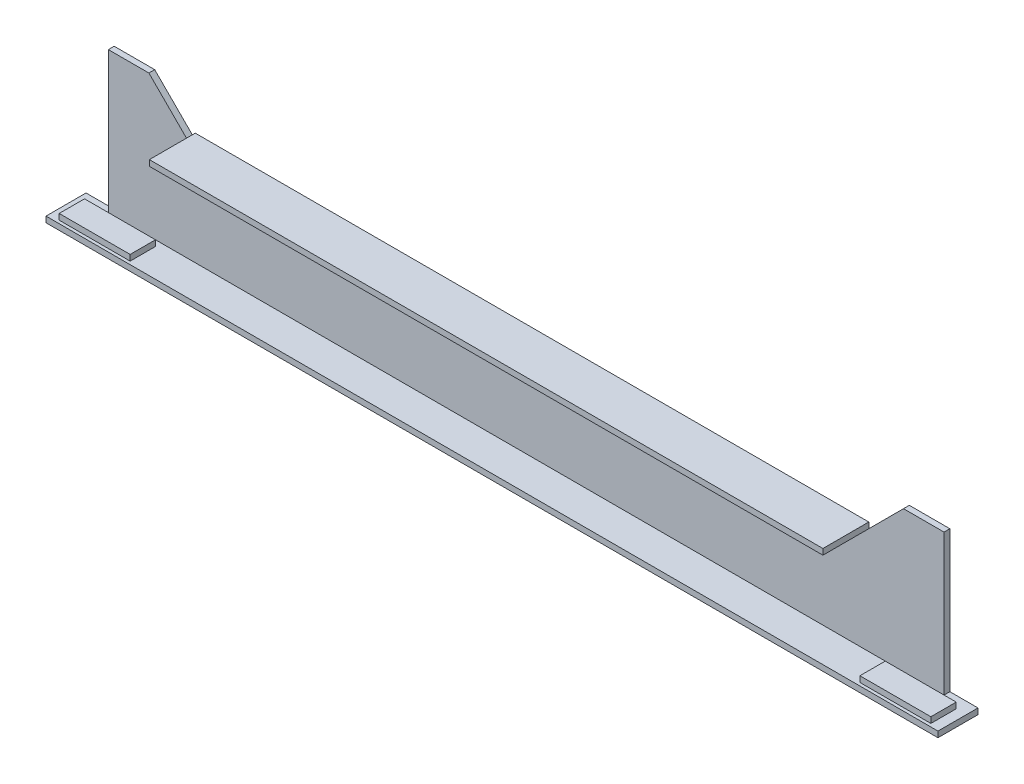
from build123d import *

# Parameters (mm, degrees)
SKETCH_1_R           = 13
EXTRUDE_675_DEPTH    = 11.5
EXTRUDE_7_DEPTH      = 79
EXTRUDE_7_DEPTH_BACK = 11.5
SKETCH_2_W           = 1329
SKETCH_2_H           = 11.5
EXTRUDE_9_DEPTH      = 67.5
EXTRUDE_9_DEPTH_BACK = 11.5
SKETCH_3_W           = 1760
SKETCH_3_H           = 11.5
SKETCH_4_W           = 140
SKETCH_4_H           = 50
EXTRUDE_10_DEPTH     = 11.5
SKETCH_6_R           = 13
CUT_EXTRUDE_1_DEPTH  = 931.962002447
EXTRUDE_11_DEPTH     = 11.5
SKETCH_8_W           = 140
SKETCH_8_H           = 50
EXTRUDE_12_DEPTH     = 23


with BuildPart() as part:
    # 草图1 → Extrude 675 (new body)
    with BuildSketch(Plane.XY):
        Polygon((-744.5, 139.25), (-664.5, 59.25), (664.5, 59.25), (744.5, 139.25), (824.5, 139.25), (824.5, -139.25), (-824.5, -139.25), (-824.5, 139.25), align=None)
        with Locations((-784.5, 99.25)):
            Circle(SKETCH_1_R, mode=Mode.SUBTRACT)
        with Locations((-784.5, 19.25)):
            Circle(SKETCH_1_R, mode=Mode.SUBTRACT)
        with Locations((-784.5, -60.75)):
            Circle(SKETCH_1_R, mode=Mode.SUBTRACT)
        with Locations(Location((784.5, -60.75, 0), (0, 0, 180))):
            Circle(SKETCH_1_R, mode=Mode.SUBTRACT)
        with Locations(Location((784.5, 19.25, 0), (0, 0, 180))):
            Circle(SKETCH_1_R, mode=Mode.SUBTRACT)
        with Locations(Location((784.5, 99.25, 0), (0, 0, 180))):
            Circle(SKETCH_1_R, mode=Mode.SUBTRACT)
    extrude(amount=EXTRUDE_675_DEPTH)

    # 草图2 → 凸台-拉伸7 (add, two sides: drawn at the far end of the back side and taken through both)
    with BuildSketch(Plane.XY.offset(11.5).offset(-EXTRUDE_7_DEPTH_BACK)):
        with Locations((0, 65)):
            Rectangle(SKETCH_2_W, SKETCH_2_H)
    extrude(amount=EXTRUDE_7_DEPTH + EXTRUDE_7_DEPTH_BACK)

    # 草图3 → 凸台-拉伸9 (add, two sides: drawn at the far end of the back side and taken through both)
    with BuildSketch(Plane.XY.offset(11.5).offset(-EXTRUDE_9_DEPTH_BACK)):
        with Locations((0, -145)):
            Rectangle(SKETCH_3_W, SKETCH_3_H)
    extrude(amount=EXTRUDE_9_DEPTH + EXTRUDE_9_DEPTH_BACK)

    # 草图4 → 凸台-拉伸10 (add)
    with BuildSketch(Plane(origin=(0, -139.25, 0), x_dir=(-1, 0, 0), z_dir=(0, 1, 0))):
        with Locations((-790, 48)):
            Rectangle(SKETCH_4_W, SKETCH_4_H)
        with Locations((790, 48)):
            Rectangle(SKETCH_4_W, SKETCH_4_H)
    extrude(amount=EXTRUDE_10_DEPTH)

    # 草图6 → 切除-拉伸1 (cut, through all)
    with BuildSketch(Plane.XZ.offset(150.75)):
        with Locations((-840, 48)):
            Circle(SKETCH_6_R)
        with Locations((-760, 48)):
            Circle(SKETCH_6_R)
        with Locations(Location((760, 48, 0), (0, 0, 180))):
            Circle(SKETCH_6_R)
        with Locations(Location((840, 48, 0), (0, 0, 180))):
            Circle(SKETCH_6_R)
    extrude(amount=-CUT_EXTRUDE_1_DEPTH, mode=Mode.SUBTRACT)

    # 草图7 → 凸台-拉伸11 (add)
    with BuildSketch(Plane.XY.offset(11.5)):
        Polygon((-824.5, 139.25), (-744.5, 139.25), (-664.5, 59.25), (664.5, 59.25), (744.5, 139.25), (824.5, 139.25), (824.5, -139.25), (-824.5, -139.25), align=None)
    extrude(amount=-EXTRUDE_11_DEPTH)

    # 草图8 → 凸台-拉伸12 (add)
    with BuildSketch(Plane(origin=(0, -127.75, 0), x_dir=(1, 0, 0), z_dir=(0, 1, 0))):
        with Locations((-790, -48)):
            Rectangle(SKETCH_8_W, SKETCH_8_H)
        with Locations((790, -48)):
            Rectangle(SKETCH_8_W, SKETCH_8_H)
    extrude(amount=-EXTRUDE_12_DEPTH)


solid = part.part
